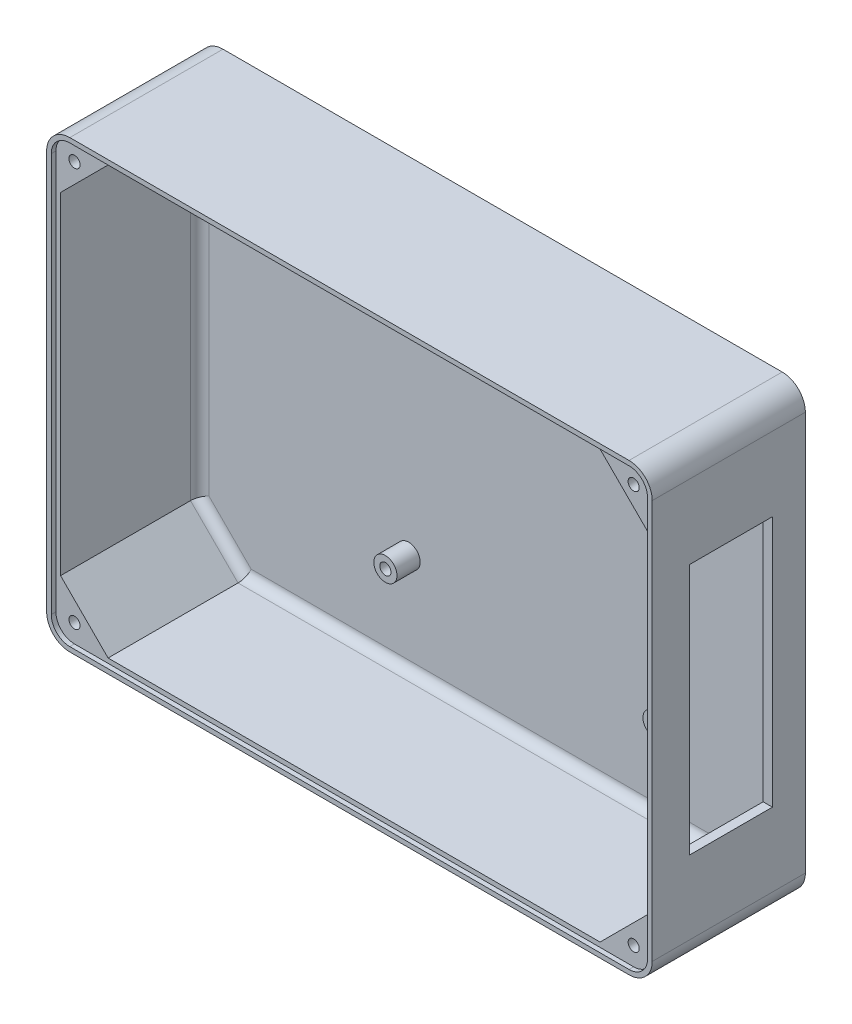
from build123d import *

# Parameters (mm, degrees)
BOSS_EXTRUDE1_DEPTH = 2
BOSS_EXTRUDE2_START = 30
SKETCH2_R           = 3
BOSS_EXTRUDE2_DEPTH = 30
SKETCH3_R           = 1.2
CUT_EXTRUDE1_DEPTH  = 25
BOSS_EXTRUDE3_START = 1
BOSS_EXTRUDE3_DEPTH = 1
SKETCH6_W           = 17.83
SKETCH6_H           = 54.204820934
CUT_EXTRUDE2_DEPTH  = 2
SKETCH7_R           = 2.5
SKETCH7_R_2         = 1.375
SKETCH7_R_3         = 1.2
BOSS_EXTRUDE4_DEPTH = 5
FILLET1_R           = 2


with BuildPart() as part:
    # Sketch1 → Boss-Extrude1 (new body)
    with BuildSketch(Plane(origin=(0, 0, -5), x_dir=(-1, 0, 0), z_dir=(0, 0, -1))):
        with BuildLine():
            Line((77.100439502, -47.051685991), (197.59949644, -47.051685991))
            ThreePointArc((197.59949644, -47.051685991), (201.135030346, -45.587219897), (202.59949644, -42.051685991))
            Line((202.59949644, -42.051685991), (202.59949644, 43.948314009))
            ThreePointArc((202.59949644, 43.948314009), (201.135030346, 47.483847915), (197.59949644, 48.948314009))
            Line((197.59949644, 48.948314009), (77.100439502, 48.948314009))
            ThreePointArc((77.100439502, 48.948314009), (73.564905596, 47.483847915), (72.100439502, 43.948314009))
            Line((72.100439502, 43.948314009), (72.100439502, -42.051685991))
            ThreePointArc((72.100439502, -42.051685991), (73.564905596, -45.587219897), (77.100439502, -47.051685991))
        make_face()
    extrude(amount=BOSS_EXTRUDE1_DEPTH)

    # Sketch2 → Boss-Extrude2 (add)
    # profile 1 of 7: a face of its own
    with BuildSketch(Plane.XY.offset(-5).offset(BOSS_EXTRUDE2_START)):
        with BuildLine():
            ThreePointArc((-202.59949644, -42.051685991), (-201.135030346, -45.587219897), (-197.59949644, -47.051685991))
            Line((-197.59949644, -47.051685991), (-77.100439502, -47.051685991))
            ThreePointArc((-77.100439502, -47.051685991), (-73.564905596, -45.587219897), (-72.100439502, -42.051685991))
            Line((-72.100439502, -42.051685991), (-72.100439502, 43.948314009))
            ThreePointArc((-72.100439502, 43.948314009), (-73.564905596, 47.483847915), (-77.100439502, 48.948314009))
            Line((-77.100439502, 48.948314009), (-197.59949644, 48.948314009))
            ThreePointArc((-197.59949644, 48.948314009), (-201.135030346, 47.483847915), (-202.59949644, 43.948314009))
            Line((-202.59949644, 43.948314009), (-202.59949644, -42.051685991))
        make_face()
        with BuildLine():
            Line((-74.100439502, -34.809045304), (-74.100439502, -42.051685991))
            ThreePointArc((-74.100439502, -42.051685991), (-74.979119158, -44.173006334), (-77.100439502, -45.051685991))
            Line((-77.100439502, -45.051685991), (-84.343080189, -45.051685991))
            Line((-84.343080189, -45.051685991), (-190.356855753, -45.051685991))
            Line((-190.356855753, -45.051685991), (-197.59949644, -45.051685991))
            ThreePointArc((-197.59949644, -45.051685991), (-199.720816783, -44.173006334), (-200.59949644, -42.051685991))
            Line((-200.59949644, -42.051685991), (-200.59949644, -34.809045304))
            Line((-200.59949644, -34.809045304), (-200.59949644, 36.705673322))
            Line((-200.59949644, 36.705673322), (-200.59949644, 43.948314009))
            ThreePointArc((-200.59949644, 43.948314009), (-199.720816783, 46.069634353), (-197.59949644, 46.948314009))
            Line((-197.59949644, 46.948314009), (-190.356855753, 46.948314009))
            Line((-190.356855753, 46.948314009), (-84.343080189, 46.948314009))
            Line((-84.343080189, 46.948314009), (-77.100439502, 46.948314009))
            ThreePointArc((-77.100439502, 46.948314009), (-74.979119158, 46.069634353), (-74.100439502, 43.948314009))
            Line((-74.100439502, 43.948314009), (-74.100439502, 36.705673322))
            Line((-74.100439502, 36.705673322), (-74.100439502, -34.809045304))
        make_face(mode=Mode.SUBTRACT)
    # profile 2 of 7: a face of its own
    with BuildSketch(Plane.XY.offset(-5).offset(BOSS_EXTRUDE2_START)):
        with BuildLine():
            Line((-197.59949644, -45.051685991), (-190.356855753, -45.051685991))
            Line((-190.356855753, -45.051685991), (-200.59949644, -34.809045304))
            Line((-200.59949644, -34.809045304), (-200.59949644, -42.051685991))
            ThreePointArc((-200.59949644, -42.051685991), (-199.720816783, -44.173006334), (-197.59949644, -45.051685991))
        make_face()
    # profile 3 of 7: a face of its own
    with BuildSketch(Plane.XY.offset(-5).offset(BOSS_EXTRUDE2_START)):
        with BuildLine():
            Line((-200.59949644, 36.705673322), (-190.356855753, 46.948314009))
            Line((-190.356855753, 46.948314009), (-197.59949644, 46.948314009))
            ThreePointArc((-197.59949644, 46.948314009), (-199.720816783, 46.069634353), (-200.59949644, 43.948314009))
            Line((-200.59949644, 43.948314009), (-200.59949644, 36.705673322))
        make_face()
    # profile 4 of 7: a face of its own
    with BuildSketch(Plane.XY.offset(-5).offset(BOSS_EXTRUDE2_START)):
        with BuildLine():
            Line((-84.343080189, 46.948314009), (-74.100439502, 36.705673322))
            Line((-74.100439502, 36.705673322), (-74.100439502, 43.948314009))
            ThreePointArc((-74.100439502, 43.948314009), (-74.979119158, 46.069634353), (-77.100439502, 46.948314009))
            Line((-77.100439502, 46.948314009), (-84.343080189, 46.948314009))
        make_face()
    # profile 5 of 7: a face of its own
    with BuildSketch(Plane.XY.offset(-5).offset(BOSS_EXTRUDE2_START)):
        with BuildLine():
            ThreePointArc((-79.221759818, -39.93036562), (-75.952389187, -39.280047401), (-74.100439502, -42.051685991))
            Line((-74.100439502, -42.051685991), (-74.100439502, -34.809045304))
            Line((-74.100439502, -34.809045304), (-79.221759818, -39.93036562))
        make_face()
    # profile 6 of 7: a face of its own
    with BuildSketch(Plane.XY.offset(-5).offset(BOSS_EXTRUDE2_START)):
        with Locations((-77.100439502, -42.051685991)):
            Circle(SKETCH2_R)
    # profile 7 of 7: a face of its own
    with BuildSketch(Plane.XY.offset(-5).offset(BOSS_EXTRUDE2_START)):
        with BuildLine():
            Line((-84.343080189, -45.051685991), (-77.100439502, -45.051685991))
            ThreePointArc((-77.100439502, -45.051685991), (-79.872078107, -43.19973627), (-79.221759818, -39.93036562))
            Line((-79.221759818, -39.93036562), (-84.343080189, -45.051685991))
        make_face()
    extrude(amount=-BOSS_EXTRUDE2_DEPTH)

    # Sketch3 → Cut-Extrude1 (cut)
    with BuildSketch(Plane.XY.offset(25)):
        with Locations((-197.59949644, -42.051685991)):
            Circle(SKETCH3_R)
        with Locations(Location((-77.100439502, -42.051685991, 0), (0, 0, 180))):
            Circle(SKETCH3_R)
        with Locations(Location((-197.59949644, 43.948314009, 0), (0, 0, 180))):
            Circle(SKETCH3_R)
        with Locations((-77.100439502, 43.948314009)):
            Circle(SKETCH3_R)
    extrude(amount=-CUT_EXTRUDE1_DEPTH, mode=Mode.SUBTRACT)

    # Sketch4 → Boss-Extrude3 (add)
    with BuildSketch(Plane.XY.offset(25).offset(BOSS_EXTRUDE3_START)):
        with BuildLine():
            Line((-202.59949644, 43.948314009), (-202.59949644, -42.051685991))
            ThreePointArc((-202.59949644, -42.051685991), (-201.135030346, -45.587219897), (-197.59949644, -47.051685991))
            Line((-197.59949644, -47.051685991), (-77.100439502, -47.051685991))
            ThreePointArc((-77.100439502, -47.051685991), (-73.564905596, -45.587219897), (-72.100439502, -42.051685991))
            Line((-72.100439502, -42.051685991), (-72.100439502, 43.948314009))
            ThreePointArc((-72.100439502, 43.948314009), (-73.564905596, 47.483847915), (-77.100439502, 48.948314009))
            Line((-77.100439502, 48.948314009), (-197.59949644, 48.948314009))
            ThreePointArc((-197.59949644, 48.948314009), (-201.135030346, 47.483847915), (-202.59949644, 43.948314009))
        make_face()
        with BuildLine():
            Line((-201.59949644, 43.948314009), (-201.59949644, -42.051685991))
            ThreePointArc((-201.59949644, -42.051685991), (-200.427923565, -44.880113116), (-197.59949644, -46.051685991))
            Line((-197.59949644, -46.051685991), (-77.100439502, -46.051685991))
            ThreePointArc((-77.100439502, -46.051685991), (-74.272012377, -44.880113116), (-73.100439502, -42.051685991))
            Line((-73.100439502, -42.051685991), (-73.100439502, 43.948314009))
            ThreePointArc((-73.100439502, 43.948314009), (-74.272012377, 46.776741134), (-77.100439502, 47.948314009))
            Line((-77.100439502, 47.948314009), (-197.59949644, 47.948314009))
            ThreePointArc((-197.59949644, 47.948314009), (-200.427923565, 46.776741134), (-201.59949644, 43.948314009))
        make_face(mode=Mode.SUBTRACT)
    extrude(amount=-BOSS_EXTRUDE3_DEPTH)

    # Sketch6 → Cut-Extrude2 (cut)
    with BuildSketch(Plane(origin=(-72.100439502, 0, 0), x_dir=(0, 0, -1), z_dir=(1, 0, 0))):
        with Locations((-9.015, 0.893058013)):
            Rectangle(SKETCH6_W, SKETCH6_H)
    extrude(amount=-CUT_EXTRUDE2_DEPTH, mode=Mode.SUBTRACT)

    # Sketch7 → Boss-Extrude4 (add)
    # profile 1 of 8: a face of its own
    with BuildSketch(Plane.XY.offset(-5)):
        with Locations(Location((-155.600439502, -23.551685991, 0), (0, 0, 180))):
            Circle(SKETCH7_R)
        with Locations((-155.600439502, -23.551685991)):
            Circle(SKETCH7_R_2, mode=Mode.SUBTRACT)
    # profile 2 of 8: a face of its own
    with BuildSketch(Plane.XY.offset(-5)):
        with Locations((-155.600439502, -23.551685991)):
            Circle(SKETCH7_R_2)
        with Locations((-155.600439502, -23.551685991)):
            Circle(SKETCH7_R_3, mode=Mode.SUBTRACT)
    # profile 3 of 8: a face of its own
    with BuildSketch(Plane.XY.offset(-5)):
        with Locations(Location((-155.600439502, 25.448314009, 0), (0, 0, 180))):
            Circle(SKETCH7_R)
        with Locations((-155.600439502, 25.448314009)):
            Circle(SKETCH7_R_2, mode=Mode.SUBTRACT)
    # profile 4 of 8: a face of its own
    with BuildSketch(Plane.XY.offset(-5)):
        with Locations((-155.600439502, 25.448314009)):
            Circle(SKETCH7_R_2)
        with Locations((-155.600439502, 25.448314009)):
            Circle(SKETCH7_R_3, mode=Mode.SUBTRACT)
    # profile 5 of 8: a face of its own
    with BuildSketch(Plane.XY.offset(-5)):
        with Locations(Location((-97.600439502, 25.448314009, 0), (0, 0, 180))):
            Circle(SKETCH7_R)
        with Locations((-97.600439502, 25.448314009)):
            Circle(SKETCH7_R_2, mode=Mode.SUBTRACT)
    # profile 6 of 8: a face of its own
    with BuildSketch(Plane.XY.offset(-5)):
        with Locations((-97.600439502, 25.448314009)):
            Circle(SKETCH7_R_2)
        with Locations((-97.600439502, 25.448314009)):
            Circle(SKETCH7_R_3, mode=Mode.SUBTRACT)
    # profile 7 of 8: a face of its own
    with BuildSketch(Plane.XY.offset(-5)):
        with Locations(Location((-97.600439502, -23.551685991, 0), (0, 0, 180))):
            Circle(SKETCH7_R)
        with Locations((-97.600439502, -23.551685991)):
            Circle(SKETCH7_R_2, mode=Mode.SUBTRACT)
    # profile 8 of 8: a face of its own
    with BuildSketch(Plane.XY.offset(-5)):
        with Locations((-97.600439502, -23.551685991)):
            Circle(SKETCH7_R_2)
        with Locations((-97.600439502, -23.551685991)):
            Circle(SKETCH7_R_3, mode=Mode.SUBTRACT)
    extrude(amount=BOSS_EXTRUDE4_DEPTH)

    # Fillet1
    fillet1_edges = [part.edges().sort_by_distance(p)[0] for p in [
        (-79.221759845, -39.930365647, -5),
        (-195.478176096, 41.826993666, -5),
        (-74.100439502, 0.948314009, -5),
        (-79.221759845, 41.826993666, -5),
        (-137.349967971, 46.948314009, -5),
        (-200.59949644, 0.948314009, -5),
        (-195.478176096, -39.930365647, -5),
        (-137.349967971, -45.051685991, -5),
    ]]
    fillet(fillet1_edges, radius=FILLET1_R)


solid = part.part
